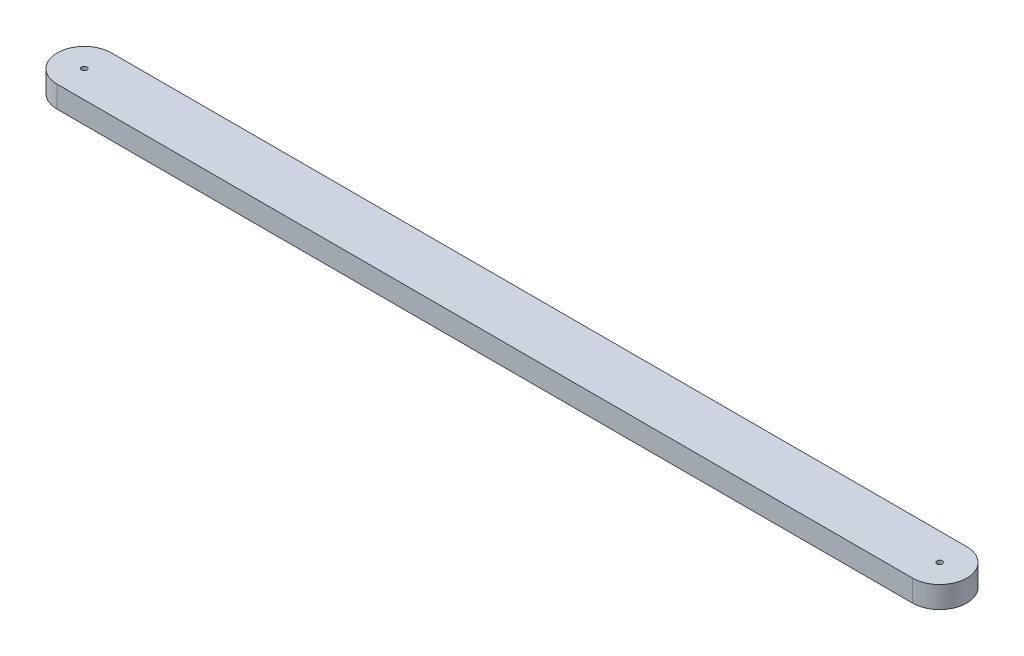
from build123d import *

# Parameters (mm, degrees)
BOSS_EXTRUDE1_DEPTH      = 2
BOSS_EXTRUDE1_DEPTH_BACK = 2
SKETCH1_R                = 0.5


with BuildPart() as part:
    # Sketch1 → Boss-Extrude1 (new, two sides: drawn at the far end of the back side and taken through both)
    with BuildSketch(Plane(origin=(0, 0, 0), x_dir=(1, 0, 0), z_dir=(0, 1, 0)).offset(-BOSS_EXTRUDE1_DEPTH_BACK)):
        with BuildLine():
            ThreePointArc((-78.805, 5), (-83.805, 0), (-78.805, -5))
            Line((-78.805, -5), (78.805, -5))
            ThreePointArc((78.805, -5), (83.805, 0), (78.805, 5))
            Line((78.805, 5), (-78.805, 5))
        make_face()
        with Locations((-78.805, 0)):
            Circle(SKETCH1_R, mode=Mode.SUBTRACT)
        with Locations((78.805, 0)):
            Circle(SKETCH1_R, mode=Mode.SUBTRACT)
    extrude(amount=BOSS_EXTRUDE1_DEPTH + BOSS_EXTRUDE1_DEPTH_BACK)


solid = part.part
